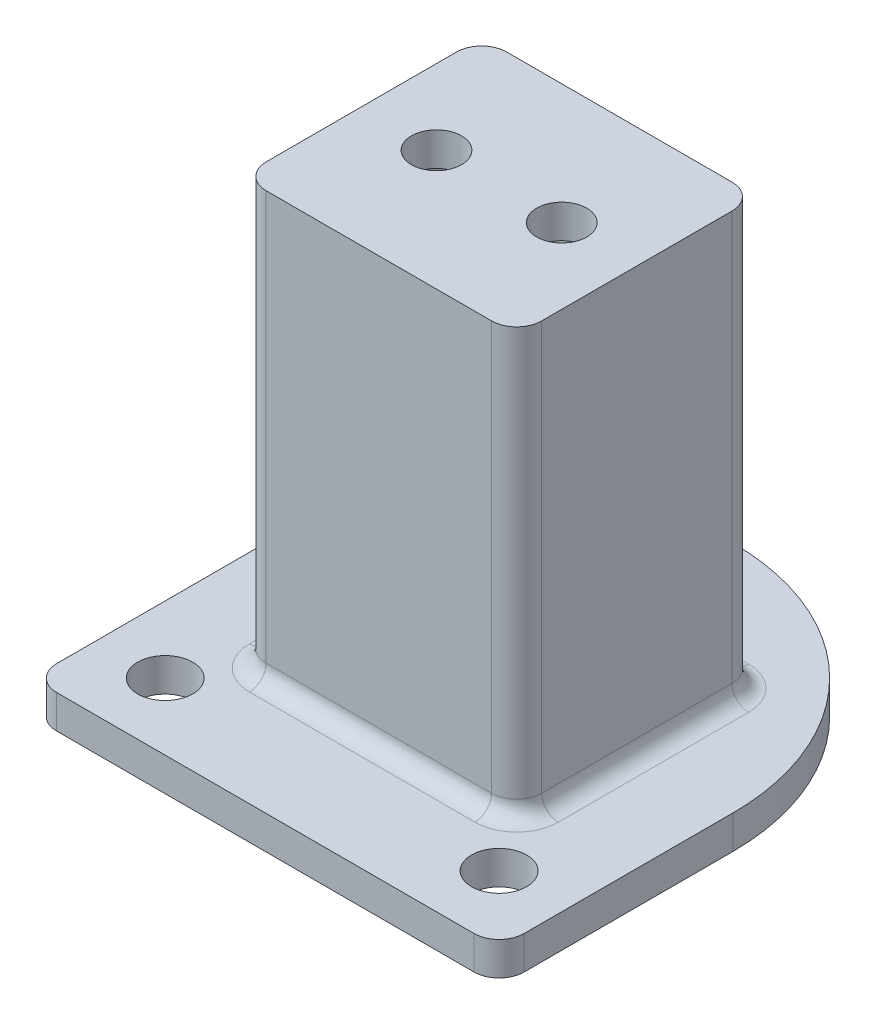
from build123d import *

# Parameters (mm, degrees)
SKETCH_1_R      = 1.65
EXTRUDE_1_DEPTH = 2
EXTRUDE_3_DEPTH = 23.5
SKETCH_3_R      = 1.5
EXTRUDE_4_DEPTH = 2
FILLET_1_R      = 1


with BuildPart() as part:
    # 草图1 → 凸台-拉伸1 (new body)
    # profile 1 of 2: a face of its own
    with BuildSketch(Plane(origin=(0, 0, 0), x_dir=(1, 0, 0), z_dir=(0, 1, 0))):
        with BuildLine():
            ThreePointArc((0, 1.5), (0.439339828, 0.439339828), (1.5, 0))
            Line((1.5, 0), (26.5, 0))
            ThreePointArc((26.5, 0), (27.560660172, 0.439339828), (28, 1.5))
            Line((28, 1.5), (28, 14))
            ThreePointArc((28, 14), (27.225183212, 18.592878075), (24.986495855, 22.677379145))
            ThreePointArc((24.986495855, 22.677379145), (22.833273811, 22.833273811), (22.677379145, 24.986495855))
            ThreePointArc((22.677379145, 24.986495855), (18.592878075, 27.225183212), (14, 28))
            Line((14, 28), (1.5, 28))
            ThreePointArc((1.5, 28), (0.439339828, 27.560660172), (0, 26.5))
            Line((0, 26.5), (0, 1.5))
        make_face()
        with Locations(Location((4, 4, 0), (0, 0, 270))):
            Circle(SKETCH_1_R, mode=Mode.SUBTRACT)
        with Locations(Location((24, 4, 0), (0, 0, 270))):
            Circle(SKETCH_1_R, mode=Mode.SUBTRACT)
        with Locations(Location((4, 24, 0), (0, 0, 270))):
            Circle(SKETCH_1_R, mode=Mode.SUBTRACT)
        with BuildLine():
            Line((18.75, 8.8), (9.25, 8.8))
            ThreePointArc((9.25, 8.8), (8.189339828, 9.239339828), (7.75, 10.3))
            Line((7.75, 10.3), (7.75, 17.7))
            ThreePointArc((7.75, 17.7), (8.189339828, 18.760660172), (9.25, 19.2))
            Line((9.25, 19.2), (18.75, 19.2))
            ThreePointArc((18.75, 19.2), (19.810660172, 18.760660172), (20.25, 17.7))
            Line((20.25, 17.7), (20.25, 10.3))
            ThreePointArc((20.25, 10.3), (19.810660172, 9.239339828), (18.75, 8.8))
        make_face(mode=Mode.SUBTRACT)
    # profile 2 of 2: a face of its own
    with BuildSketch(Plane(origin=(0, 0, 0), x_dir=(1, 0, 0), z_dir=(0, 1, 0))):
        with BuildLine():
            ThreePointArc((22.677379145, 24.986495855), (22.833273811, 22.833273811), (24.986495855, 22.677379145))
            ThreePointArc((24.986495855, 22.677379145), (23.899494937, 23.899494937), (22.677379145, 24.986495855))
        make_face()
    extrude(amount=EXTRUDE_1_DEPTH)

    # 草图2 → 凸台-拉伸3 (add)
    with BuildSketch(Plane(origin=(0, 2, 0), x_dir=(1, 0, 0), z_dir=(0, 1, 0))):
        with BuildLine():
            Line((7.25, 21.2), (20.75, 21.2))
            ThreePointArc((20.75, 21.2), (21.810660172, 20.760660172), (22.25, 19.7))
            Line((22.25, 19.7), (22.25, 8.3))
            ThreePointArc((22.25, 8.3), (21.810660172, 7.239339828), (20.75, 6.8))
            Line((20.75, 6.8), (7.25, 6.8))
            ThreePointArc((7.25, 6.8), (6.189339828, 7.239339828), (5.75, 8.3))
            Line((5.75, 8.3), (5.75, 19.7))
            ThreePointArc((5.75, 19.7), (6.189339828, 20.760660172), (7.25, 21.2))
        make_face()
        with BuildLine():
            Line((9.25, 19.2), (18.75, 19.2))
            ThreePointArc((18.75, 19.2), (19.810660172, 18.760660172), (20.25, 17.7))
            Line((20.25, 17.7), (20.25, 10.3))
            ThreePointArc((20.25, 10.3), (19.810660172, 9.239339828), (18.75, 8.8))
            Line((18.75, 8.8), (9.25, 8.8))
            ThreePointArc((9.25, 8.8), (8.189339828, 9.239339828), (7.75, 10.3))
            Line((7.75, 10.3), (7.75, 17.7))
            ThreePointArc((7.75, 17.7), (8.189339828, 18.760660172), (9.25, 19.2))
        make_face(mode=Mode.SUBTRACT)
    extrude(amount=EXTRUDE_3_DEPTH)

    # 草图3 → 凸台-拉伸4 (add)
    with BuildSketch(Plane(origin=(0, 25.5, 0), x_dir=(1, 0, 0), z_dir=(0, 1, 0))):
        with BuildLine():
            Line((22.25, 8.3), (22.25, 19.7))
            ThreePointArc((22.25, 19.7), (21.810660172, 20.760660172), (20.75, 21.2))
            Line((20.75, 21.2), (7.25, 21.2))
            ThreePointArc((7.25, 21.2), (6.189339828, 20.760660172), (5.75, 19.7))
            Line((5.75, 19.7), (5.75, 8.3))
            ThreePointArc((5.75, 8.3), (6.189339828, 7.239339828), (7.25, 6.8))
            Line((7.25, 6.8), (20.75, 6.8))
            ThreePointArc((20.75, 6.8), (21.810660172, 7.239339828), (22.25, 8.3))
        make_face()
        with Locations(Location((10.25, 14, 0), (0, 0, 270))):
            Circle(SKETCH_3_R, mode=Mode.SUBTRACT)
        with Locations(Location((17.75, 14, 0), (0, 0, 90))):
            Circle(SKETCH_3_R, mode=Mode.SUBTRACT)
    extrude(amount=EXTRUDE_4_DEPTH)

    # 圆角1
    fillet_1_edges = [part.edges().sort_by_distance(p)[0] for p in [
        (5.75, 2, -14),
        (14, 2, -21.2),
        (22.25, 2, -14),
        (14, 2, -6.8),
        (6.189339828, 2, -7.239339828),
        (21.810660172, 2, -7.239339828),
        (21.810660172, 2, -20.760660172),
        (6.189339828, 2, -20.760660172),
    ]]
    fillet(fillet_1_edges, radius=FILLET_1_R)


solid = part.part
